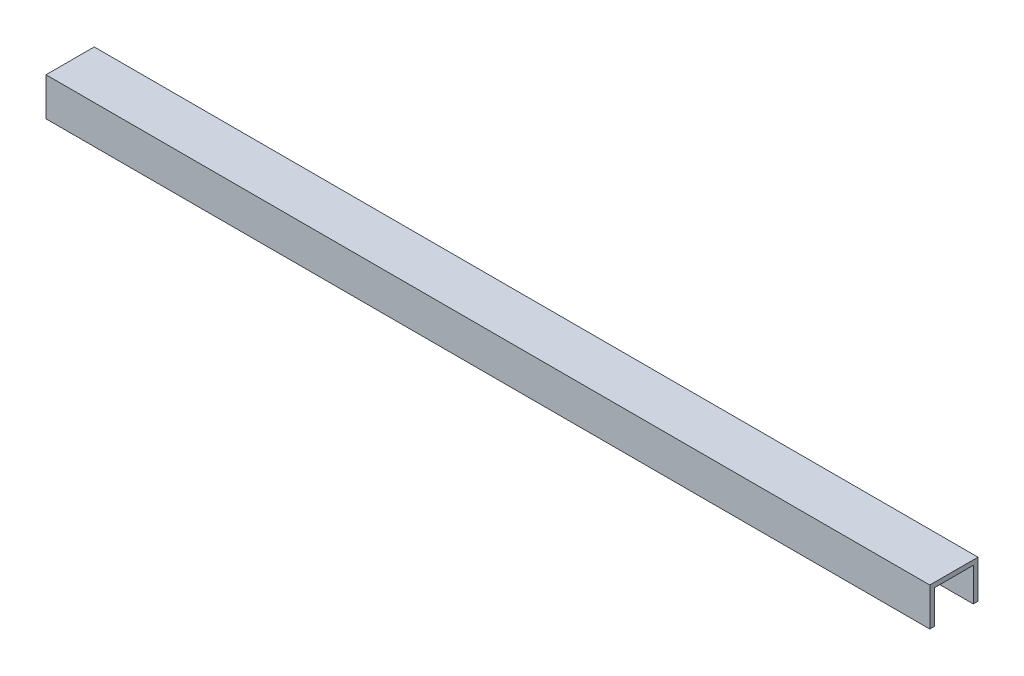
from build123d import *

# Parameters (mm, degrees)
END_CHANNEL_DEPTH = 147.02


with BuildPart() as part:
    # end channel sketch → end channel (new, symmetric)
    with BuildSketch(Plane(origin=(0, 0, 0), x_dir=(0, 0, -1), z_dir=(1, 0, 0))):
        Polygon((-13.83, 294.27), (-13.83, 306.97), (-29.87, 306.97), (-29.87, 294.27), (-28.3, 294.27), (-28.3, 305.4), (-15.4, 305.4), (-15.4, 294.27), align=None)
    extrude(amount=END_CHANNEL_DEPTH, both=True)


solid = part.part
